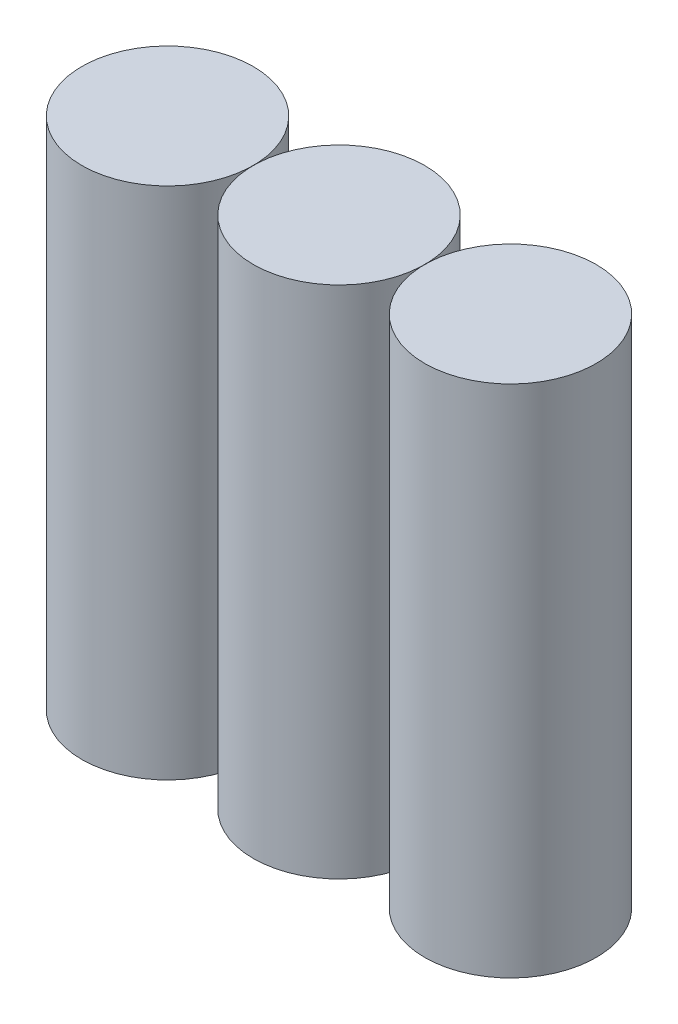
from build123d import *

# Parameters (mm, degrees)
SKETCH1_R           = 2.5
BOSS_EXTRUDE1_DEPTH = 15


with BuildPart() as part:
    # Sketch1 → Boss-Extrude1 (new body)
    with BuildSketch(Plane(origin=(0, 0, 0), x_dir=(1, 0, 0), z_dir=(0, 1, 0))):
        with BuildLine():
            ThreePointArc((-2.5, 0), (0, -2.5), (2.5, 0))
            ThreePointArc((2.5, 0), (0, 2.5), (-2.5, 0))
        make_face()
        with BuildLine():
            ThreePointArc((7.5, 0), (5, 2.5), (2.5, 0))
            Line((2.5, 0), (7.5, 0))
        make_face()
        with BuildLine():
            Line((7.5, 0), (2.5, 0))
            ThreePointArc((2.5, 0), (5, -2.5), (7.5, 0))
        make_face()
        with Locations(Location((-5, 0, 0), (0, 0, 270))):
            Circle(SKETCH1_R)
    extrude(amount=BOSS_EXTRUDE1_DEPTH)


solid = part.part
